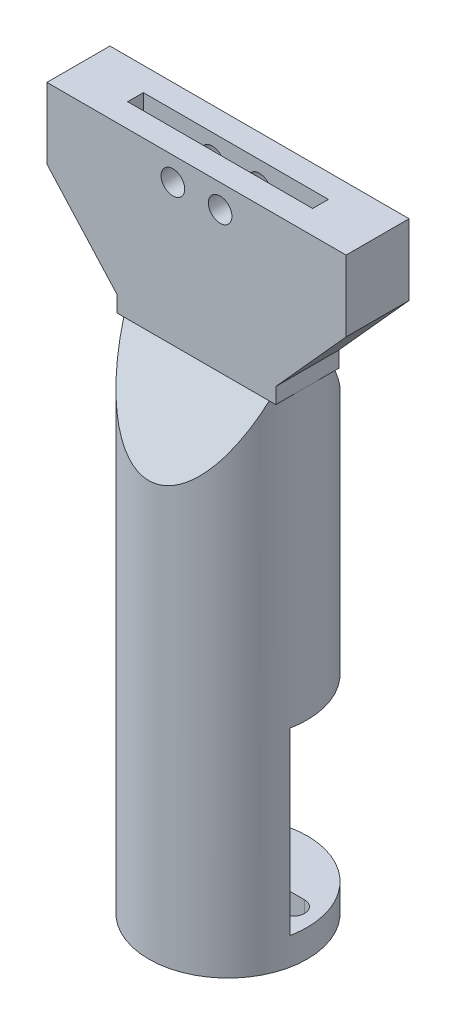
from build123d import *

# Parameters (mm, degrees)
BOSS_EXTRUDE1_DEPTH = 8
SKETCH3_R           = 10.068967795
BOSS_EXTRUDE2_DEPTH = 63
CUT_EXTRUDE1_DEPTH  = 83
SKETCH7_R           = 1.5
CUT_EXTRUDE2_DEPTH  = 10
SKETCH9_W           = 23.5
SKETCH9_H           = 2
CUT_EXTRUDE3_DEPTH  = 8
SKETCH10_W          = 12.086915154
SKETCH10_H          = 22.82391002
CUT_EXTRUDE4_DEPTH  = 48
CUT_EXTRUDE5_DEPTH  = 14


with BuildPart() as part:
    # Sketch2 → Boss-Extrude1 (new body)
    with BuildSketch(Plane.XY):
        Polygon((0, 0), (38, 0), (38, -9), (29.068967795, -18.918916137), (29.068967795, -20.918916137), (8.931032205, -20.918916137), (8.931032205, -18.918916137), (0, -9), align=None)
    extrude(amount=BOSS_EXTRUDE1_DEPTH)

    # Sketch3 → Boss-Extrude2 (add)
    with BuildSketch(Plane.XZ.offset(20.918916137)):
        with Locations((19, 4)):
            Circle(SKETCH3_R)
    extrude(amount=BOSS_EXTRUDE2_DEPTH)

    # Sketch4 → Cut-Extrude1 (cut)
    with BuildSketch(Plane(origin=(0, 0, 0), x_dir=(0, 0, -1), z_dir=(1, 0, 0))):
        Polygon((0, -20.918916137), (6.068967795, -31.271096096), (6.068967795, -20.918916137), align=None)
        Polygon((-14.068967795, -20.918916137), (-8, -20.918916137), (-14.068967795, -31.271096096), align=None)
    extrude(amount=CUT_EXTRUDE1_DEPTH, mode=Mode.SUBTRACT)

    # Sketch7 → Cut-Extrude2 (cut)
    with BuildSketch(Plane(origin=(0, 0, 0), x_dir=(-1, 0, 0), z_dir=(0, 0, -1))):
        with Locations((-22, -3)):
            Circle(SKETCH7_R)
        with Locations((-16, -3)):
            Circle(SKETCH7_R)
    extrude(amount=-CUT_EXTRUDE2_DEPTH, mode=Mode.SUBTRACT)

    # Sketch9 → Cut-Extrude3 (cut)
    with BuildSketch(Plane(origin=(0, 0, 0), x_dir=(1, 0, 0), z_dir=(0, 1, 0))):
        with Locations((19, -4)):
            Rectangle(SKETCH9_W, SKETCH9_H)
    extrude(amount=-CUT_EXTRUDE3_DEPTH, mode=Mode.SUBTRACT)

    # Sketch10 → Cut-Extrude4 (cut)
    with BuildSketch(Plane(origin=(0, 0, 0), x_dir=(0, 0, -1), z_dir=(1, 0, 0))):
        with Locations((0.025510218, -69.006961127)):
            Rectangle(SKETCH10_W, SKETCH10_H)
    extrude(amount=CUT_EXTRUDE4_DEPTH, mode=Mode.SUBTRACT)

    # Sketch12 → Cut-Extrude5 (cut)
    with BuildSketch(Plane.XZ.offset(83.918916137)):
        with BuildLine():
            Line((12.623924181, 4.142800634), (25.864458584, 4.142800634))
            ThreePointArc((25.864458584, 4.142800634), (27.364458584, 2.642800634), (25.864458584, 1.142800634))
            Line((25.864458584, 1.142800634), (12.623924181, 1.142800634))
            ThreePointArc((12.623924181, 1.142800634), (11.123924181, 2.642800634), (12.623924181, 4.142800634))
        make_face()
    extrude(amount=-CUT_EXTRUDE5_DEPTH, mode=Mode.SUBTRACT)


solid = part.part
